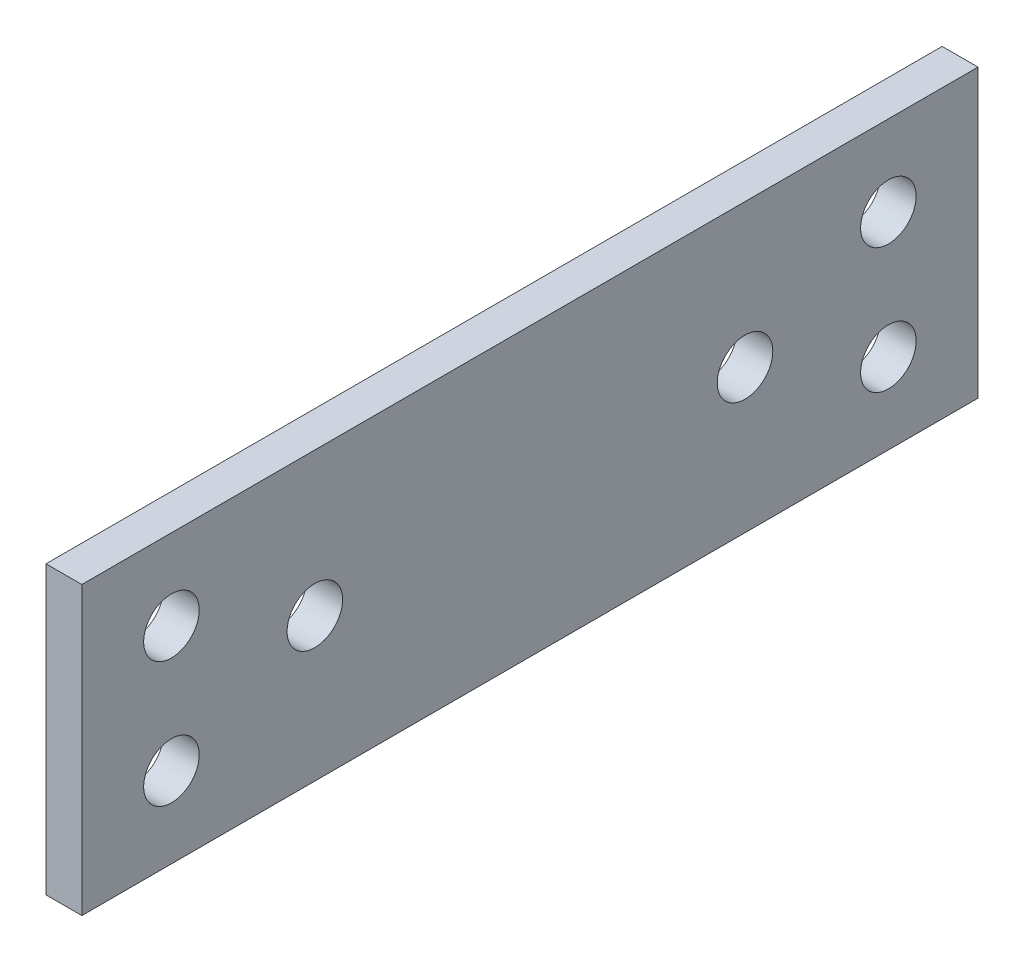
from build123d import *

# Parameters (mm, degrees)
SKETCH_1_W      = 50
SKETCH_1_H      = 16
SKETCH_1_R      = 1.55
EXTRUDE_1_DEPTH = 2


with BuildPart() as part:
    # 草图1 → 凸台-拉伸1 (new body)
    with BuildSketch(Plane(origin=(0, 0, 0), x_dir=(0, 0, -1), z_dir=(1, 0, 0))):
        Rectangle(SKETCH_1_W, SKETCH_1_H)
        with Locations((-12, 0)):
            Circle(SKETCH_1_R, mode=Mode.SUBTRACT)
        with Locations((-20, 3.5)):
            Circle(SKETCH_1_R, mode=Mode.SUBTRACT)
        with Locations((-20, -3.5)):
            Circle(SKETCH_1_R, mode=Mode.SUBTRACT)
        with Locations((20, 3.5)):
            Circle(SKETCH_1_R, mode=Mode.SUBTRACT)
        with Locations((20, -3.5)):
            Circle(SKETCH_1_R, mode=Mode.SUBTRACT)
        with Locations((12, 0)):
            Circle(SKETCH_1_R, mode=Mode.SUBTRACT)
    extrude(amount=EXTRUDE_1_DEPTH)


solid = part.part
